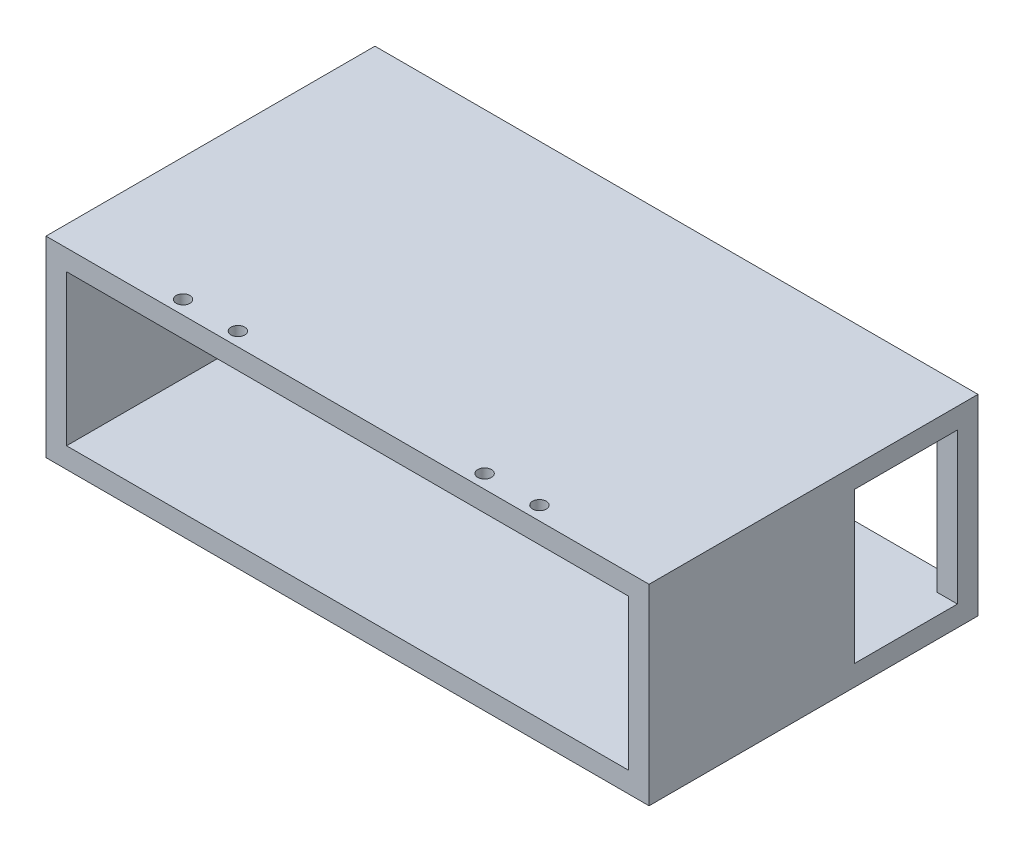
from build123d import *

# Parameters (mm, degrees)
SKETCH_1_W          = 88
SKETCH_1_H          = 28
EXTRUDE_1_DEPTH     = 48
SHELL_1_T           = -3
SKETCH_2_R          = 1
CUT_EXTRUDE_1_DEPTH = 3
SKETCH_5_W          = 15
SKETCH_5_H          = 22
CUT_EXTRUDE_4_DEPTH = 107.412344412
SKETCH_6_W          = 15
SKETCH_6_H          = 22
CUT_EXTRUDE_5_DEPTH = 15


with BuildPart() as part:
    # 草圖1 → 填料-伸長1 (new body)
    with BuildSketch(Plane.XY):
        with Locations((-13.67483766, 21.715361446)):
            Rectangle(SKETCH_1_W, SKETCH_1_H)
    extrude(amount=EXTRUDE_1_DEPTH)

    # 薄殼1
    shell_1_openings = [part.faces().sort_by_distance(p)[0] for p in [
        (-13.67483766, 21.715361446, 48),
    ]]
    offset(amount=SHELL_1_T, openings=shell_1_openings, kind=Kind.INTERSECTION)

    # 草圖2 → 除料-伸長1 (cut)
    with BuildSketch(Plane(origin=(0, 35.715361446, 0), x_dir=(1, 0, 0), z_dir=(0, 1, 0))):
        with Locations(Location((-31.67483766, -46, 0), (0, 0, 270))):
            Circle(SKETCH_2_R)
        with Locations(Location((-39.67483766, -46, 0), (0, 0, 270))):
            Circle(SKETCH_2_R)
        with Locations(Location((12.32516234, -46, 0), (0, 0, 90))):
            Circle(SKETCH_2_R)
        with Locations(Location((4.32516234, -46, 0), (0, 0, 90))):
            Circle(SKETCH_2_R)
    extrude(amount=-CUT_EXTRUDE_1_DEPTH, mode=Mode.SUBTRACT)

    # 草圖5 → 除料-伸長4 (cut, through all)
    with BuildSketch(Plane.ZY.offset(57.67483766)):
        with Locations((10.5, 21.715361446)):
            Rectangle(SKETCH_5_W, SKETCH_5_H)
    extrude(amount=-CUT_EXTRUDE_4_DEPTH, mode=Mode.SUBTRACT)

    # 草圖6 → 除料-伸長5 (cut)
    with BuildSketch(Plane(origin=(0, 0, 0), x_dir=(-1, 0, 0), z_dir=(0, 0, -1))):
        with Locations((-19.82516234, 21.715361446)):
            Rectangle(SKETCH_6_W, SKETCH_6_H)
        with Locations((47.17483766, 21.715361446)):
            Rectangle(SKETCH_6_W, SKETCH_6_H)
    extrude(amount=-CUT_EXTRUDE_5_DEPTH, mode=Mode.SUBTRACT)


solid = part.part
